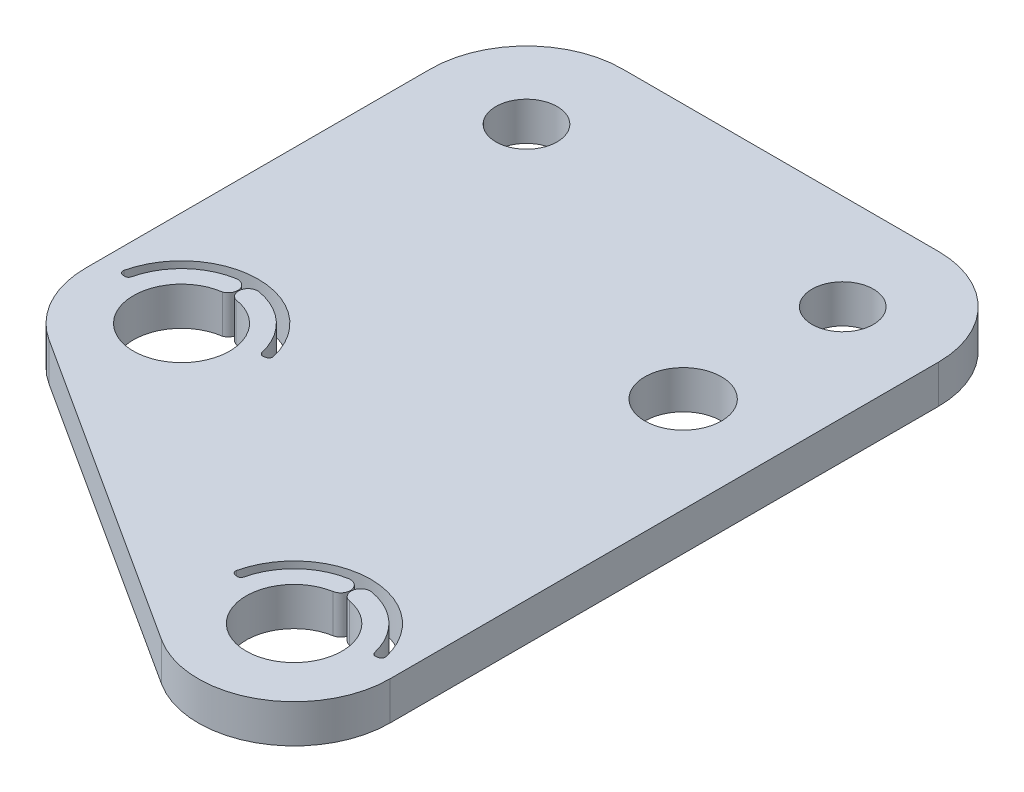
from build123d import *

# Parameters (mm, degrees)
SKETCH1_R           = 2.51
SKETCH1_R_2         = 2.5
SKETCH1_R_3         = 1.6
SKETCH1_R_4         = 2
BOSS_EXTRUDE1_DEPTH = 2
FILLET1_R           = 5
CUT_EXTRUDE2_DEPTH  = 47.884332404


with BuildPart() as part:
    # Sketch1 → Boss-Extrude1 (new body)
    with BuildSketch(Plane(origin=(0, 0, 0), x_dir=(1, 0, 0), z_dir=(0, 1, 0))):
        Polygon((0, 0), (26.5, 0), (26.5, -42.791666667), (0, -25.727272727), align=None)
        with Locations(Location((5, -23, 0), (0, 0, 270))):
            Circle(SKETCH1_R, mode=Mode.SUBTRACT)
        with Locations(Location((21.5, -33.625, 0), (0, 0, 270))):
            Circle(SKETCH1_R_2, mode=Mode.SUBTRACT)
        with Locations(Location((21.5, -5, 0), (0, 0, 270))):
            Circle(SKETCH1_R_3, mode=Mode.SUBTRACT)
        with Locations(Location((5, -5, 0), (0, 0, 270))):
            Circle(SKETCH1_R_3, mode=Mode.SUBTRACT)
        with Locations(Location((21.5, -13.325, 0), (0, 0, 270))):
            Circle(SKETCH1_R_4, mode=Mode.SUBTRACT)
    extrude(amount=BOSS_EXTRUDE1_DEPTH)

    # Fillet1
    fillet1_edges = [part.edges().sort_by_distance(p)[0] for p in [
        (0, 1, 0),
        (26.5, 1, 0),
        (26.5, 1, 42.791666667),
        (0, 1, 25.727272727),
    ]]
    fillet(fillet1_edges, radius=FILLET1_R)

    # Sketch2 → Cut-Extrude2 (cut, through all)
    with BuildSketch(Plane(origin=(0, 2, 0), x_dir=(1, 0, 0), z_dir=(0, 1, 0))):
        with BuildLine():
            Line((17.861538493, -32.983441068), (17.762917332, -32.966051496))
            ThreePointArc((17.762917332, -32.966051496), (17.630853466, -32.879452656), (17.602786281, -32.724042048))
            ThreePointArc((17.602786281, -32.724042048), (21.5, -29.625), (25.397213719, -32.724042048))
            ThreePointArc((25.397213719, -32.724042048), (25.369146534, -32.879452656), (25.237082668, -32.966051496))
            Line((25.237082668, -32.966051496), (25.138461507, -32.983441068))
            ThreePointArc((25.138461507, -32.983441068), (24.993487988, -32.953351583), (24.908935554, -32.831804949))
            ThreePointArc((24.908935554, -32.831804949), (23.907056069, -31.084118051), (22.107768622, -30.178172864))
            ThreePointArc((22.107768622, -30.178172864), (21.528540656, -30.583752652), (21.934120444, -31.162980617))
            ThreePointArc((21.934120444, -31.162980617), (21.5, -31.125), (21.065879556, -31.162980617))
            ThreePointArc((21.065879556, -31.162980617), (21.471459344, -30.583752652), (20.892231378, -30.178172864))
            ThreePointArc((20.892231378, -30.178172864), (19.092943931, -31.084118051), (18.091064446, -32.831804949))
            ThreePointArc((18.091064446, -32.831804949), (18.006512012, -32.953351583), (17.861538493, -32.983441068))
        make_face()
        with BuildLine():
            Line((1.361538493, -22.358441068), (1.262917332, -22.341051496))
            ThreePointArc((1.262917332, -22.341051496), (1.130853466, -22.254452656), (1.102786281, -22.099042048))
            ThreePointArc((1.102786281, -22.099042048), (5, -19), (8.897213719, -22.099042048))
            ThreePointArc((8.897213719, -22.099042048), (8.869146534, -22.254452656), (8.737082668, -22.341051496))
            Line((8.737082668, -22.341051496), (8.638461507, -22.358441068))
            ThreePointArc((8.638461507, -22.358441068), (8.493487988, -22.328351583), (8.408935554, -22.206804949))
            ThreePointArc((8.408935554, -22.206804949), (7.407056069, -20.459118051), (5.607768622, -19.553172864))
            ThreePointArc((5.607768622, -19.553172864), (5.028540656, -19.958752652), (5.434120444, -20.537980617))
            ThreePointArc((5.434120444, -20.537980617), (5, -20.5), (4.565879556, -20.537980617))
            ThreePointArc((4.565879556, -20.537980617), (4.971459344, -19.958752652), (4.392231378, -19.553172864))
            ThreePointArc((4.392231378, -19.553172864), (2.592943931, -20.459118051), (1.591064446, -22.206804949))
            ThreePointArc((1.591064446, -22.206804949), (1.506512012, -22.328351583), (1.361538493, -22.358441068))
        make_face()
    extrude(amount=-CUT_EXTRUDE2_DEPTH, mode=Mode.SUBTRACT)


solid = part.part
